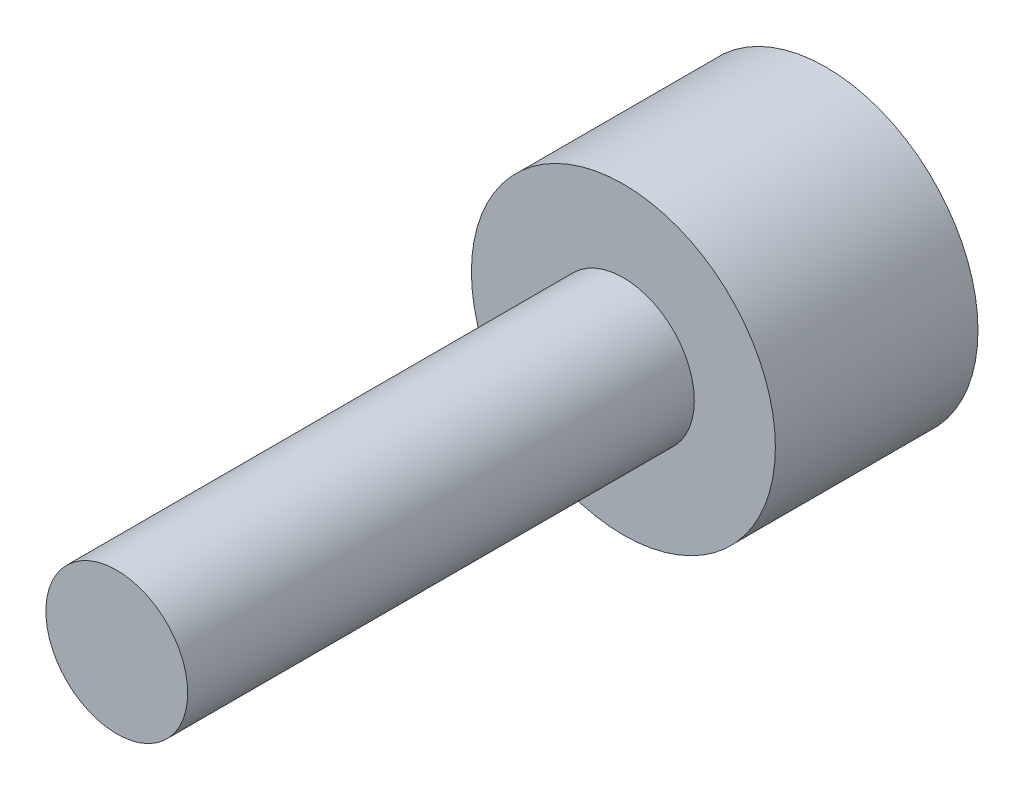
from build123d import *

# Parameters (mm, degrees)
SKETCH1_R           = 7.5
BOSS_EXTRUDE1_DEPTH = 10
SKETCH2_R           = 3.5
CUT_EXTRUDE1_DEPTH  = 10
SKETCH3_R           = 3.5
BOSS_EXTRUDE2_DEPTH = 25


with BuildPart() as part:
    # Sketch1 → Boss-Extrude1 (new body)
    with BuildSketch(Plane.XY):
        Circle(SKETCH1_R)
    extrude(amount=BOSS_EXTRUDE1_DEPTH)

    # Sketch2 → Cut-Extrude1 (cut)
    with BuildSketch(Plane.XY.offset(10)):
        Circle(SKETCH2_R)
    extrude(amount=-CUT_EXTRUDE1_DEPTH, mode=Mode.SUBTRACT)


with BuildPart() as body_2:
    # Sketch3 → Boss-Extrude2 (new body)
    with BuildSketch(Plane.XY.offset(10)):
        Circle(SKETCH3_R)
    extrude(amount=BOSS_EXTRUDE2_DEPTH)


solid = Compound([part.part, body_2.part])
